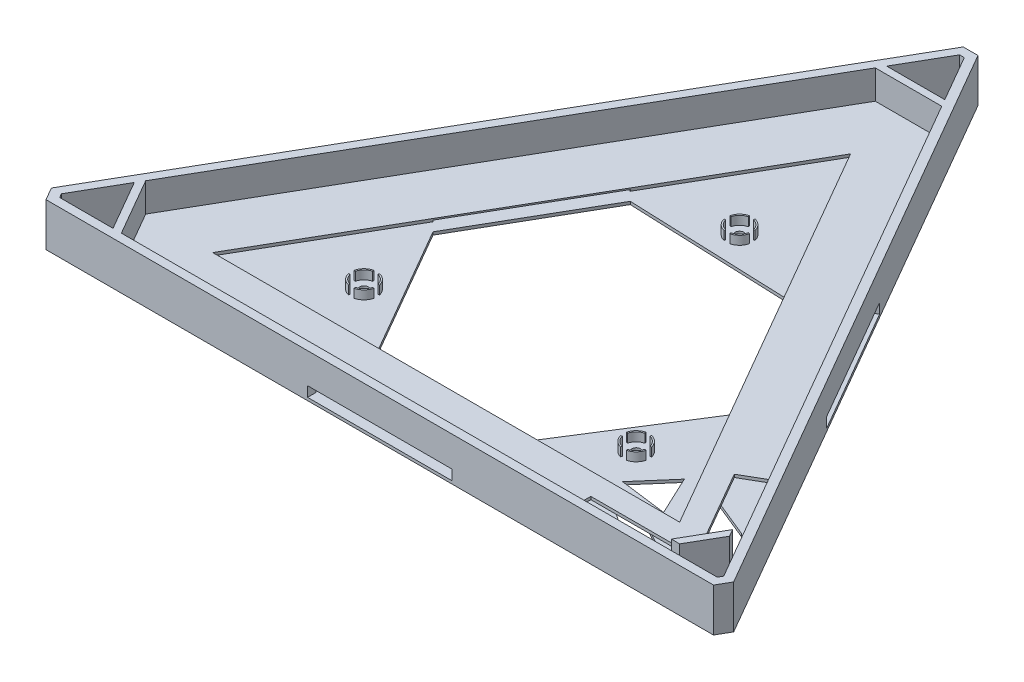
from build123d import *

# Parameters (mm, degrees)
SKETCH1_W                = 34.714871787
SKETCH1_H                = 10.923666426
BOSS_EXTRUDE1_DEPTH      = 1
BOSS_EXTRUDE2_DEPTH      = 11
BOSS_EXTRUDE3_DEPTH      = 5
BOSS_EXTRUDE3_DEPTH_BACK = 3
SKETCH3_W                = 50
SKETCH3_H                = 7
CUT_EXTRUDE3_DEPTH       = 25
SKETCH5_W                = 50
SKETCH5_H                = 7
CUT_EXTRUDE4_DEPTH       = 25
SKETCH6_W                = 50
SKETCH6_H                = 7
CUT_EXTRUDE5_DEPTH       = 25
SKETCH8_R                = 1.5
BOSS_EXTRUDE5_DEPTH      = 1
BOSS_EXTRUDE10_DEPTH     = 3


with BuildPart() as part:
    # Sketch1 → Boss-Extrude1 (new body)
    with BuildSketch(Plane(origin=(0, 0, 0), x_dir=(1, 0, 0), z_dir=(0, 1, 0))):
        Polygon((243.304219775, -116.484791865), (254.809280577, -136.408896137), (442.602090749, -136.409305398), (444.621046679, -132.925433224), (441.749040748, -132.925433224), (449.516726724, -119.471406458), (450.964695298, -121.978953123), (452.699916622, -118.984688018), (358.778179036, 43.666038065), (335.767496284, 43.666038065), align=None)
        with Locations((422.370878913, -129.522754792)):
            Rectangle(SKETCH1_W, SKETCH1_H, mode=Mode.SUBTRACT)
        Polygon((423.190377512, -92.577472767), (432.651287025, -87.114324326), (450.119365975, -117.364996826), (440.658456462, -122.828145267), align=None, mode=Mode.SUBTRACT)
        Polygon((428.113670919, -116.417164681), (266.439108268, -116.428009237), (347.273609729, 23.609230821), align=None, mode=Mode.SUBTRACT)
    extrude(amount=BOSS_EXTRUDE1_DEPTH)

    # Sketch1<9> → Boss-Extrude2 (add)
    # profile 1 of 2: a face of its own
    with BuildSketch(Plane(origin=(0, 0, 0), x_dir=(1, 0, 0), z_dir=(0, 1, 0))):
        Polygon((229.159432548, -134.984249184), (231.716666588, -139.412373829), (462.829865412, -139.412373829), (465.38624875, -134.984588004), (349.829542096, 65.165499075), (344.716133219, 65.165499075), align=None)
        Polygon((251.922647989, -136.409305399), (233.446303401, -136.408896138), (232.62355396, -134.984217357), (241.860901689, -118.984688018), align=None, mode=Mode.SUBTRACT)
        Polygon((442.602090749, -136.409305398), (254.809280577, -136.408896137), (243.304219775, -116.484791865), (335.767496284, 43.666038065), (358.778179036, 43.666038065), (461.938967958, -134.984588006), (461.116393749, -136.409305398), align=None, mode=Mode.SUBTRACT)
        Polygon((348.096628302, 62.164013367), (357.334800991, 46.166038067), (337.210874326, 46.166038067), (346.44844193, 62.165948237), align=None, mode=Mode.SUBTRACT)
    # profile 2 of 2: a face of its own
    with BuildSketch(Plane(origin=(0, 0, 0), x_dir=(1, 0, 0), z_dir=(0, 1, 0))):
        Polygon((441.749040748, -132.925433224), (444.621046679, -132.925433224), (450.964695298, -121.978953123), (449.516726724, -119.471406458), align=None)
    extrude(amount=BOSS_EXTRUDE2_DEPTH)

    # Sketch1<10> → Boss-Extrude3 (add, two sides: drawn at the far end of the back side and taken through both)
    # profile 1 of 2: a face of its own
    with BuildSketch(Plane(origin=(0, 0, 0), x_dir=(1, 0, 0), z_dir=(0, 1, 0)).offset(-BOSS_EXTRUDE3_DEPTH_BACK)):
        Polygon((229.159432548, -134.984249184), (231.716666588, -139.412373829), (462.829865412, -139.412373829), (465.38624875, -134.984588004), (349.829542096, 65.165499075), (344.716133219, 65.165499075), align=None)
        Polygon((251.922647989, -136.409305399), (233.446303401, -136.408896138), (232.62355396, -134.984217357), (241.860901689, -118.984688018), align=None, mode=Mode.SUBTRACT)
        Polygon((442.602090749, -136.409305398), (254.809280577, -136.408896137), (243.304219775, -116.484791865), (335.767496284, 43.666038065), (358.778179036, 43.666038065), (461.938967958, -134.984588006), (461.116393749, -136.409305398), align=None, mode=Mode.SUBTRACT)
        Polygon((348.096628302, 62.164013367), (357.334800991, 46.166038067), (337.210874326, 46.166038067), (346.44844193, 62.165948237), align=None, mode=Mode.SUBTRACT)
    # profile 2 of 2: a face of its own
    with BuildSketch(Plane(origin=(0, 0, 0), x_dir=(1, 0, 0), z_dir=(0, 1, 0)).offset(-BOSS_EXTRUDE3_DEPTH_BACK)):
        Polygon((441.749040748, -132.925433224), (444.621046679, -132.925433224), (450.964695298, -121.978953123), (449.516726724, -119.471406458), align=None)
    extrude(amount=BOSS_EXTRUDE3_DEPTH + BOSS_EXTRUDE3_DEPTH_BACK)

    # Sketch3 → Cut-Extrude3 (cut)
    with BuildSketch(Plane(origin=(290.589645397, 0, -167.772009994), x_dir=(-0.49999999999998745, 0, -0.8660254037844459), z_dir=(0.8660254037844459, 0, -0.49999999999998745))):
        with Locations((-236.592990632, -3)):
            Rectangle(SKETCH3_W, SKETCH3_H)
    extrude(amount=-CUT_EXTRUDE3_DEPTH, mode=Mode.SUBTRACT)

    # Sketch5 → Cut-Extrude4 (cut)
    with BuildSketch(Plane.XY.offset(139.412373829)):
        with Locations((347.273266, -3)):
            Rectangle(SKETCH5_W, SKETCH5_H)
    extrude(amount=-CUT_EXTRUDE4_DEPTH, mode=Mode.SUBTRACT)

    # Sketch6 → Cut-Extrude5 (cut)
    with BuildSketch(Plane(origin=(230.319375798, 0, 132.975171837), x_dir=(-0.5000006154012504, 0, 0.8660250484820695), z_dir=(-0.8660250484820695, 0, -0.5000006154012504))):
        with Locations((-113.236674799, -3)):
            Rectangle(SKETCH6_W, SKETCH6_H)
    extrude(amount=-CUT_EXTRUDE5_DEPTH, mode=Mode.SUBTRACT)

    # Sketch8 → Boss-Extrude5 (add)
    with BuildSketch(Plane.XZ.offset(3)):
        Polygon((349.829542096, -65.165499075), (465.38624875, 134.984588004), (462.829865412, 139.412373829), (231.716666588, 139.412373829), (229.159432548, 134.984249184), (344.716133219, -65.165499075), align=None)
        with Locations((395.323540807, 98.692824234)):
            Circle(SKETCH8_R, mode=Mode.SUBTRACT)
        with Locations((348.301285091, 15.863526629)):
            Circle(SKETCH8_R, mode=Mode.SUBTRACT)
        with Locations((299.654911442, 97.24168178)):
            Circle(SKETCH8_R, mode=Mode.SUBTRACT)
        Polygon((414.793175166, 116.418058172), (444.621046679, 132.925433224), (450.964695298, 121.978953123), (423.743256024, 108.846989255), (416.453113266, 96.21943309), (438.086080689, 105.056150836), (452.699916622, 118.984688018), (461.938967958, 134.984588006), (461.116393749, 136.409305398), (442.602090749, 136.409305398), (432.302823198, 135.574995335), (404.013141868, 116.418781259), align=None, mode=Mode.SUBTRACT)
        Polygon((322.273266, 116.42426408), (294.358218631, 68.061097964), (319.354499367, 24.757680453), (376.473657316, 26.969372806), (401.47267951, 70.271207531), (372.273266, 116.420910257), align=None, mode=Mode.SUBTRACT)
        Polygon((233.446303401, 136.408896138), (251.922647989, 136.409305399), (241.860901689, 118.984688018), (232.62355396, 134.984217357), align=None, mode=Mode.SUBTRACT)
        Polygon((337.210874326, -46.166038067), (357.334800991, -46.166038067), (348.096628302, -62.164013367), (346.44844193, -62.165948237), align=None, mode=Mode.SUBTRACT)
        Polygon((418.423760883, 112.300563217), (412.029962691, 98.692824234), (402.084054392, 110.169297153), align=None, mode=Mode.SUBTRACT)
    extrude(amount=BOSS_EXTRUDE5_DEPTH)

    # Sketch12 → Boss-Extrude10 (add)
    with BuildSketch(Plane(origin=(0, -3, 0), x_dir=(1, 0, 0), z_dir=(0, 1, 0))):
        with BuildLine():
            ThreePointArc((352.690173981, -14.869718639), (351.483265607, -12.681546114), (349.295093082, -11.47463774))
            Line((349.295093081, -11.47463774), (349.184669971, -11.962292061))
            ThreePointArc((349.184669972, -11.962292061), (351.129712216, -13.035099504), (352.20251966, -14.980141749))
            Line((352.202519659, -14.980141749), (352.69017398, -14.869718639))
        make_face()
        with BuildLine():
            Line((347.417900211, -11.962292061), (347.307477101, -11.47463774))
            ThreePointArc((347.307477101, -11.47463774), (345.119304576, -12.681546114), (343.912396202, -14.869718639))
            Line((343.912396203, -14.869718639), (344.400050524, -14.980141749))
            ThreePointArc((344.400050523, -14.980141749), (345.472857967, -13.035099504), (347.417900211, -11.962292061))
        make_face()
        with BuildLine():
            ThreePointArc((349.295093082, -20.252415518), (351.483265607, -19.045507145), (352.690173981, -16.857334619))
            Line((352.69017398, -16.857334619), (352.202519659, -16.746911509))
            ThreePointArc((352.20251966, -16.746911509), (351.129712216, -18.691953754), (349.184669972, -19.764761197))
            Line((349.184669971, -19.764761197), (349.295093081, -20.252415518))
        make_face()
        with BuildLine():
            Line((344.400050524, -16.746911509), (343.912396203, -16.857334619))
            ThreePointArc((343.912396202, -16.857334619), (345.119304576, -19.045507145), (347.307477101, -20.252415518))
            Line((347.307477101, -20.252415518), (347.417900211, -19.764761197))
            ThreePointArc((347.417900211, -19.764761197), (345.472857967, -18.691953754), (344.400050523, -16.746911509))
        make_face()
        with BuildLine():
            Line((394.440155927, -94.791589666), (394.329732817, -94.303935345))
            ThreePointArc((394.329732817, -94.303935345), (392.141560292, -95.510843718), (390.934651918, -97.699016244))
            Line((390.934651918, -97.699016244), (391.4247896, -97.798542945))
            ThreePointArc((391.4247896, -97.798542945), (392.499067689, -95.860448622), (394.440155927, -94.791589666))
        make_face()
        with BuildLine():
            ThreePointArc((399.712429696, -97.699016244), (398.505521323, -95.510843718), (396.317348797, -94.303935345))
            Line((396.317348797, -94.303935345), (396.206925687, -94.791589666))
            ThreePointArc((396.206925687, -94.791589666), (398.151967932, -95.864397109), (399.224775375, -97.809439354))
            Line((399.224775375, -97.809439354), (399.712429696, -97.699016244))
        make_face()
        with BuildLine():
            Line((391.422306239, -99.576209114), (390.934651918, -99.686632224))
            ThreePointArc((390.934651918, -99.686632224), (392.141560292, -101.874804749), (394.329732817, -103.081713123))
            Line((394.329732817, -103.081713122), (394.440155927, -102.594058801))
            ThreePointArc((394.440155927, -102.594058802), (392.495113682, -101.521251358), (391.422306239, -99.576209114))
        make_face()
        with BuildLine():
            ThreePointArc((396.317348797, -103.081713123), (398.505521323, -101.874804749), (399.712429696, -99.686632224))
            Line((399.712429696, -99.686632224), (399.224775375, -99.576209114))
            ThreePointArc((399.224775375, -99.576209114), (398.151967932, -101.521251358), (396.206925687, -102.594058802))
            Line((396.206925687, -102.594058801), (396.317348797, -103.081713122))
        make_face()
        with BuildLine():
            ThreePointArc((298.661103452, -92.852792892), (296.472930927, -94.059701265), (295.266022553, -96.24787379))
            Line((295.266022553, -96.24787379), (295.753676874, -96.3582969))
            ThreePointArc((295.753676874, -96.3582969), (296.826484317, -94.413254656), (298.771526562, -93.340447213))
            Line((298.771526562, -93.340447212), (298.661103452, -92.852792891))
        make_face()
        with BuildLine():
            Line((295.753676874, -98.12506666), (295.266022553, -98.23548977))
            ThreePointArc((295.266022553, -98.23548977), (296.472930927, -100.423662295), (298.661103452, -101.630570669))
            Line((298.661103452, -101.630570669), (298.771526562, -101.142916348))
            ThreePointArc((298.771526562, -101.142916348), (296.826484317, -100.070108905), (295.753676874, -98.12506666))
        make_face()
        with BuildLine():
            ThreePointArc((304.04380033, -96.24787379), (302.836891957, -94.059701265), (300.648719432, -92.852792892))
            Line((300.648719432, -92.852792891), (300.538296322, -93.340447212))
            ThreePointArc((300.538296322, -93.340447213), (302.483338566, -94.413254656), (303.55614601, -96.3582969))
            Line((303.55614601, -96.3582969), (304.043800331, -96.24787379))
        make_face()
        with BuildLine():
            Line((300.538296322, -101.142916348), (300.648719432, -101.630570669))
            ThreePointArc((300.648719432, -101.630570669), (302.836891957, -100.423662295), (304.04380033, -98.23548977))
            Line((304.043800331, -98.23548977), (303.55614601, -98.12506666))
            ThreePointArc((303.55614601, -98.12506666), (302.483338566, -100.070108905), (300.538296322, -101.142916348))
        make_face()
    extrude(amount=BOSS_EXTRUDE10_DEPTH)


solid = part.part
